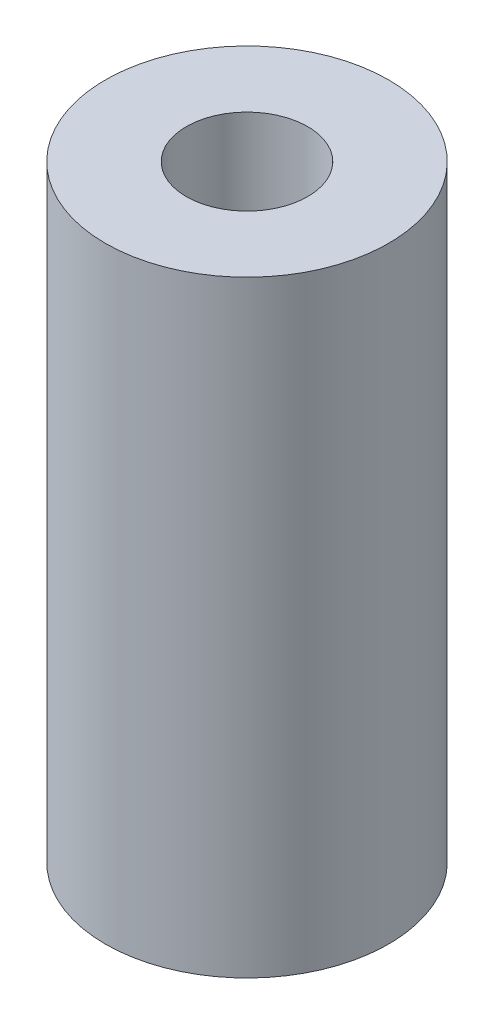
from build123d import *

# Parameters (mm, degrees)
SKETCH1_R           = 3.5
SKETCH1_R_2         = 1.5
BOSS_EXTRUDE1_DEPTH = 15


with BuildPart() as part:
    # Sketch1 → Boss-Extrude1 (new body)
    with BuildSketch(Plane(origin=(0, 0, 0), x_dir=(1, 0, 0), z_dir=(0, 1, 0))):
        with Locations(Location((0, 0, 0), (0, 0, 270))):
            Circle(SKETCH1_R)
        with Locations(Location((0, 0, 0), (0, 0, 270))):
            Circle(SKETCH1_R_2, mode=Mode.SUBTRACT)
    extrude(amount=BOSS_EXTRUDE1_DEPTH)


solid = part.part
